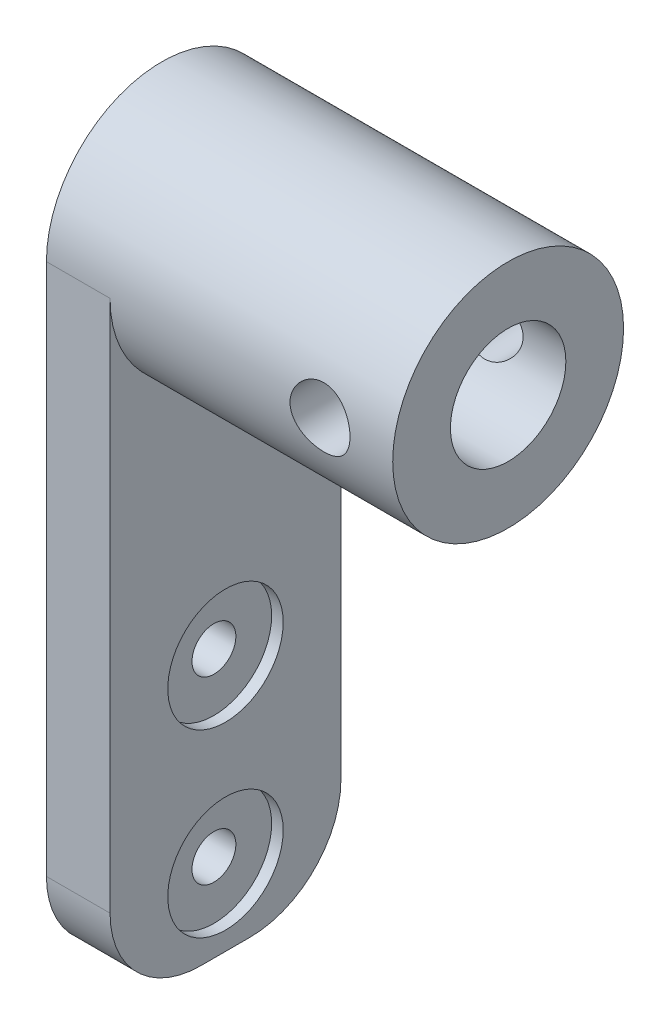
from build123d import *

# Parameters (mm, degrees)
SKETCH1_R             = 6.35
SKETCH1_R_2           = 3.175
BOSS_EXTRUDE1_DEPTH   = 19.05
M4X0_7_TAPPED_HOLE1_D = 3.3
BOSS_EXTRUDE3_DEPTH   = 3.5
FILLET2_R             = 5
SKETCH11_R            = 1.2065
CUT_EXTRUDE1_DEPTH    = 40.736999196
SKETCH12_R            = 3.175
CUT_EXTRUDE2_DEPTH    = 0.635


with BuildPart() as part:
    # Sketch1 → Boss-Extrude1 (new body)
    with BuildSketch(Plane.YZ):
        with Locations(Location((0, 0, 0), (0, 0, 90))):
            Circle(SKETCH1_R)
        with Locations(Location((0, 0, 0), (0, 0, 90))):
            Circle(SKETCH1_R_2, mode=Mode.SUBTRACT)
    extrude(amount=BOSS_EXTRUDE1_DEPTH)

    # M4x0.7 Tapped Hole1 (through all)
    with Locations(Plane(origin=(0, 0, 6.35), x_dir=(0, 1, 0), z_dir=(0, 0, 1))):
        with Locations((0, -15.05)):
            Hole(M4X0_7_TAPPED_HOLE1_D / 2)

    # Sketch10 → Boss-Extrude3 (add)
    with BuildSketch(Plane(origin=(0, 0, 0), x_dir=(0, -1, 0), z_dir=(-1, 0, 0))):
        with BuildLine():
            Line((0, 6.35), (34.29, 6.35))
            Line((34.29, 6.35), (34.29, -6.35))
            Line((34.29, -6.35), (0, -6.35))
            ThreePointArc((0, -6.35), (6.35, 0), (0, 6.35))
        make_face()
    extrude(amount=-BOSS_EXTRUDE3_DEPTH)

    # Fillet2
    fillet2_edges = [part.edges().sort_by_distance(p)[0] for p in [
        (1.75, -34.29, -6.35),
        (1.75, -34.29, 6.35),
    ]]
    fillet(fillet2_edges, radius=FILLET2_R)

    # Sketch11 → Cut-Extrude1 (cut, through all)
    with BuildSketch(Plane(origin=(0, 0, 0), x_dir=(0, -1, 0), z_dir=(-1, 0, 0))):
        with Locations(Location((30.099, 0, 0), (0, 0, 90))):
            Circle(SKETCH11_R)
        with Locations(Location((20.193, 0, 0), (0, 0, 90))):
            Circle(SKETCH11_R)
    extrude(amount=-CUT_EXTRUDE1_DEPTH, mode=Mode.SUBTRACT)

    # Sketch12 → Cut-Extrude2 (cut)
    with BuildSketch(Plane.YZ.offset(3.5)):
        with Locations(Location((-20.193, 0, 0), (0, 0, 270))):
            Circle(SKETCH12_R)
        with Locations(Location((-30.099, 0, 0), (0, 0, 270))):
            Circle(SKETCH12_R)
    extrude(amount=-CUT_EXTRUDE2_DEPTH, mode=Mode.SUBTRACT)


solid = part.part
